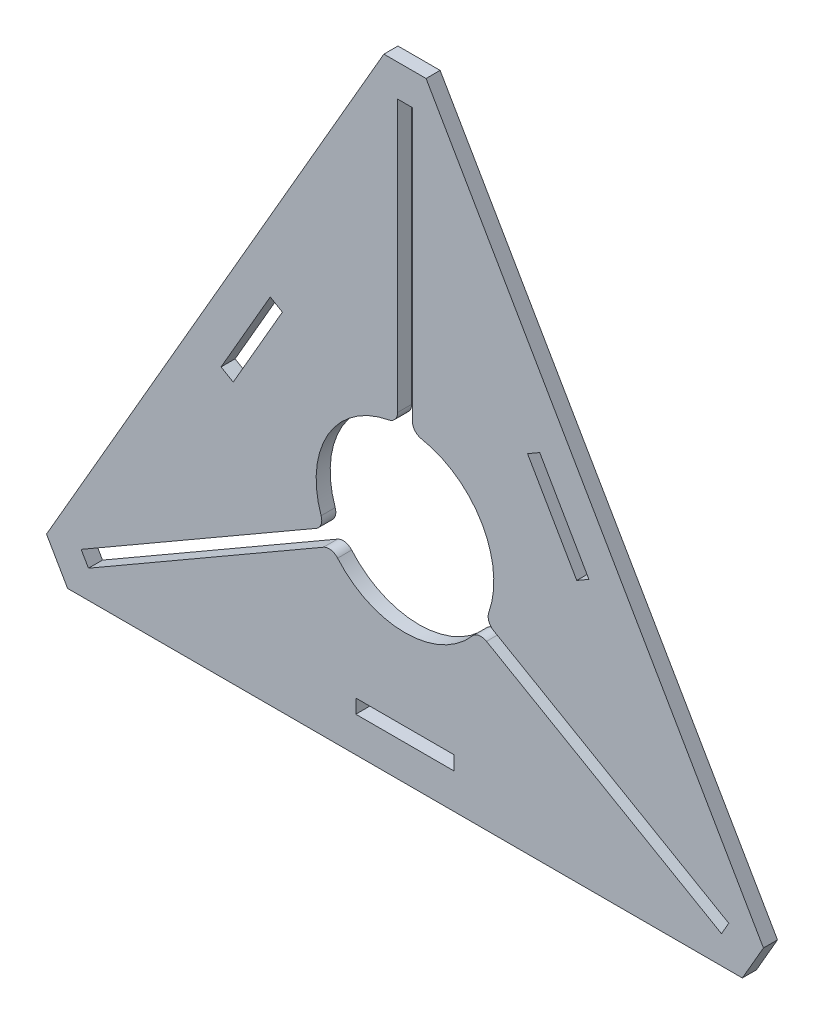
from build123d import *

# Parameters (mm, degrees)
SKETCH1_W           = 44.45
SKETCH1_H           = 6.35
BOSS_EXTRUDE1_DEPTH = 6.35


with BuildPart() as part:
    # Sketch1 → Boss-Extrude1 (new body)
    with BuildSketch(Plane.XY):
        Polygon((0, -98.986703653), (152.4, -98.986703653), (161.925, -82.48891971), (9.525, 181.475623363), (-9.525, 181.475623363), (-161.925, -82.48891971), (-152.4, -98.986703653), align=None)
        with BuildLine():
            Line((-3.302, 166.995927543), (3.302, 166.995927543))
            Line((3.302, 166.995927543), (3.302, 44.428223237))
            ThreePointArc((3.302, 44.428223237), (4.471070917, 41.186150797), (7.440202247, 39.436288042))
            ThreePointArc((7.440202247, 39.436288042), (34.755331505, 20.066), (37.872928399, -13.274739866))
            ThreePointArc((37.872928399, -13.274739866), (37.903788333, -16.721014402), (40.126969968, -19.354495735))
            Line((40.126969968, -19.354495735), (146.273715581, -80.638347888))
            Line((146.273715581, -80.638347888), (142.971715581, -86.357579655))
            Line((142.971715581, -86.357579655), (36.824969968, -25.073727502))
            ThreePointArc((36.824969968, -25.073727502), (33.432717416, -24.465136395), (30.432726152, -26.161548176))
            ThreePointArc((30.432726152, -26.161548176), (0, -40.132), (-30.432726152, -26.161548176))
            ThreePointArc((-30.432726152, -26.161548176), (-33.432717416, -24.465136395), (-36.824969968, -25.073727502))
            Line((-36.824969968, -25.073727502), (-142.971715581, -86.357579655))
            Line((-142.971715581, -86.357579655), (-146.273715581, -80.638347888))
            Line((-146.273715581, -80.638347888), (-40.126969968, -19.354495735))
            ThreePointArc((-40.126969968, -19.354495735), (-37.903788333, -16.721014402), (-37.872928399, -13.274739866))
            ThreePointArc((-37.872928399, -13.274739866), (-34.755331505, 20.066), (-7.440202247, 39.436288042))
            ThreePointArc((-7.440202247, 39.436288042), (-4.471070917, 41.186150797), (-3.302, 44.428223237))
            Line((-3.302, 44.428223237), (-3.302, 166.995927543))
        make_face(mode=Mode.SUBTRACT)
        with Locations((0, -79.936703653)):
            Rectangle(SKETCH1_W, SKETCH1_H, mode=Mode.SUBTRACT)
        Polygon((-83.089346715, 22.308437227), (-60.864346715, 60.803266425), (-55.365085401, 57.628266425), (-77.590085401, 19.133437227), align=None, mode=Mode.SUBTRACT)
        Polygon((60.864346715, 60.803266425), (55.365085401, 57.628266425), (77.590085401, 19.133437227), (83.089346715, 22.308437227), align=None, mode=Mode.SUBTRACT)
    extrude(amount=BOSS_EXTRUDE1_DEPTH)


solid = part.part
